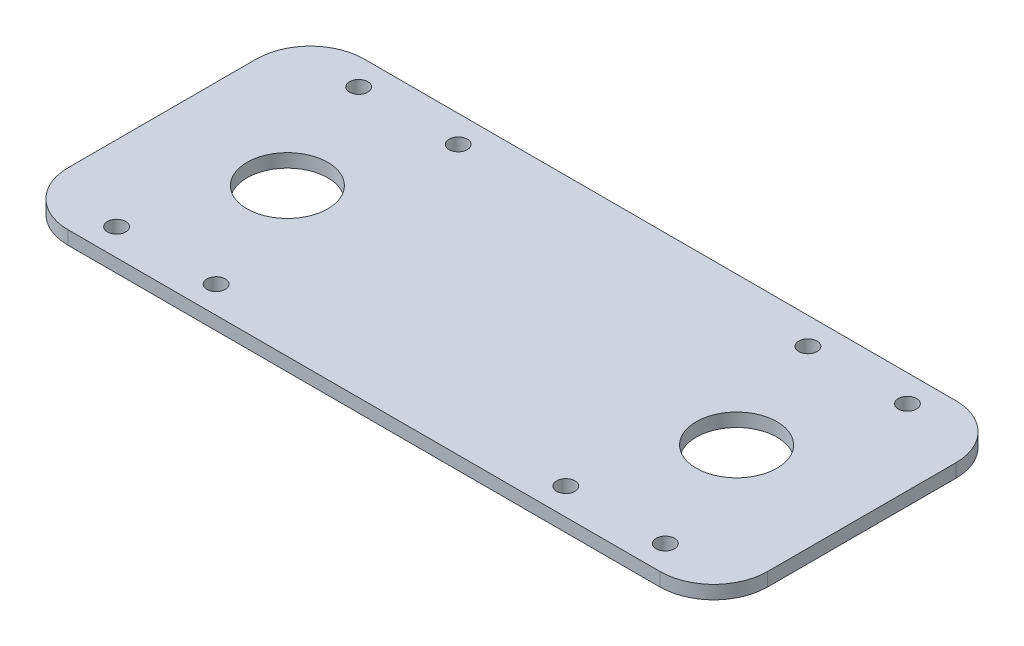
from build123d import *

# Parameters (mm, degrees)
BOSS_EXTRUDE1_DEPTH = 2.5
SKETCH2_R           = 1.7
CUT_EXTRUDE1_DEPTH  = 142.178079035
SKETCH3_R           = 1.7
CUT_EXTRUDE2_DEPTH  = 10
SKETCH4_R           = 7.5
CUT_EXTRUDE3_DEPTH  = 10


with BuildPart() as part:
    # Sketch1 → Boss-Extrude1 (new body)
    with BuildSketch(Plane(origin=(0, 0, 0), x_dir=(1, 0, 0), z_dir=(0, 1, 0))):
        with BuildLine():
            Line((10, 0), (120, 0))
            ThreePointArc((120, 0), (127.071067812, 2.928932188), (130, 10))
            Line((130, 10), (130, 45))
            ThreePointArc((130, 45), (127.071067812, 52.071067812), (120, 55))
            Line((120, 55), (10, 55))
            ThreePointArc((10, 55), (2.928932188, 52.071067812), (0, 45))
            Line((0, 45), (0, 10))
            ThreePointArc((0, 10), (2.928932188, 2.928932188), (10, 0))
        make_face()
    extrude(amount=BOSS_EXTRUDE1_DEPTH)

    # Sketch2 → Cut-Extrude1 (cut, through all)
    with BuildSketch(Plane(origin=(0, 2.5, 0), x_dir=(1, 0, 0), z_dir=(0, 1, 0))):
        with Locations(Location((14, 5, 0), (0, 0, 270))):
            Circle(SKETCH2_R)
        with Locations(Location((14, 50, 0), (0, 0, 270))):
            Circle(SKETCH2_R)
        with Locations(Location((116, 5, 0), (0, 0, 90))):
            Circle(SKETCH2_R)
        with Locations(Location((116, 50, 0), (0, 0, 90))):
            Circle(SKETCH2_R)
    extrude(amount=-CUT_EXTRUDE1_DEPTH, mode=Mode.SUBTRACT)

    # Sketch3 → Cut-Extrude2 (cut)
    with BuildSketch(Plane(origin=(0, 2.5, 0), x_dir=(1, 0, 0), z_dir=(0, 1, 0))):
        with Locations(Location((32.5, 50, 0), (0, 0, 270))):
            Circle(SKETCH3_R)
        with Locations(Location((32.5, 5, 0), (0, 0, 270))):
            Circle(SKETCH3_R)
        with Locations(Location((97.5, 5, 0), (0, 0, 270))):
            Circle(SKETCH3_R)
        with Locations(Location((97.5, 50, 0), (0, 0, 270))):
            Circle(SKETCH3_R)
    extrude(amount=-CUT_EXTRUDE2_DEPTH, mode=Mode.SUBTRACT)

    # Sketch4 → Cut-Extrude3 (cut)
    with BuildSketch(Plane(origin=(0, 2.5, 0), x_dir=(1, 0, 0), z_dir=(0, 1, 0))):
        with Locations(Location((23.25, 27.5, 0), (0, 0, 270))):
            Circle(SKETCH4_R)
        with Locations(Location((106.75, 27.5, 0), (0, 0, 270))):
            Circle(SKETCH4_R)
    extrude(amount=-CUT_EXTRUDE3_DEPTH, mode=Mode.SUBTRACT)


solid = part.part
